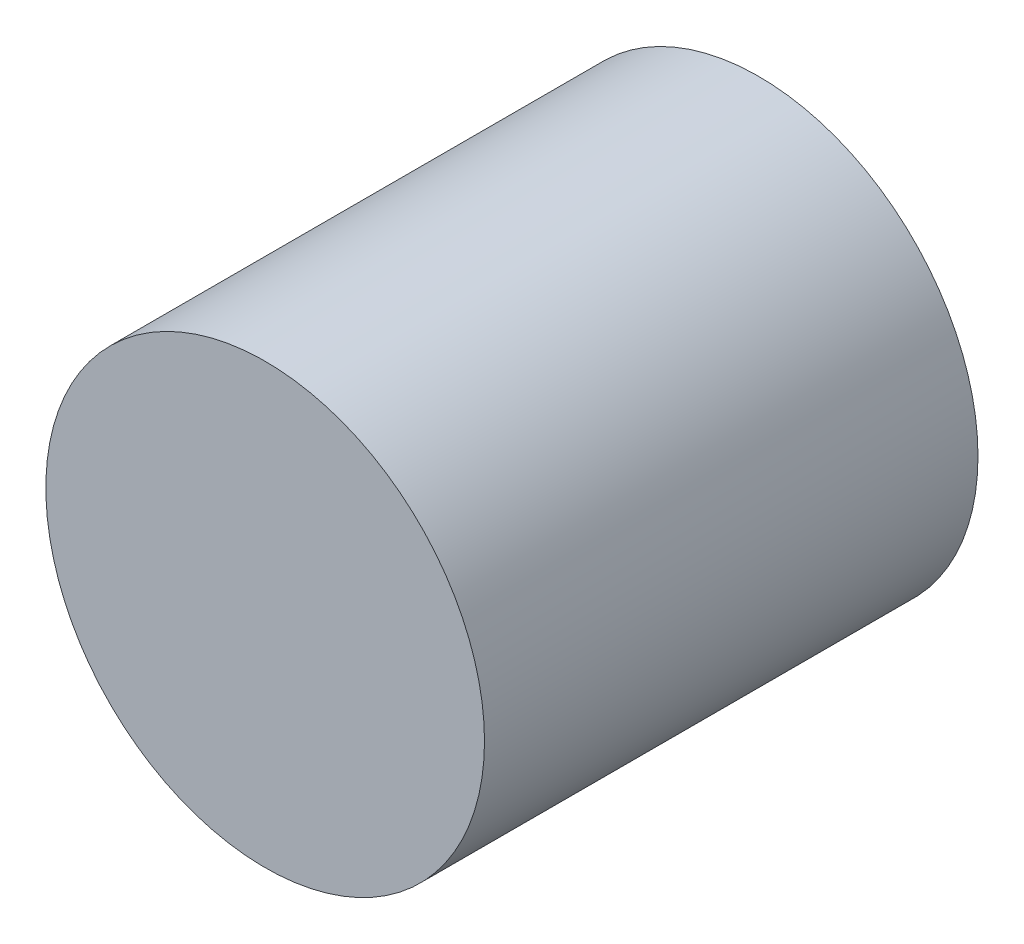
from build123d import *

# Parameters (mm, degrees)
SKETCH1_R           = 2
BOSS_EXTRUDE1_DEPTH = 4.5


with BuildPart() as part:
    # Sketch1 → Boss-Extrude1 (new body)
    with BuildSketch(Plane.XY):
        Circle(SKETCH1_R)
    extrude(amount=BOSS_EXTRUDE1_DEPTH)


solid = part.part
